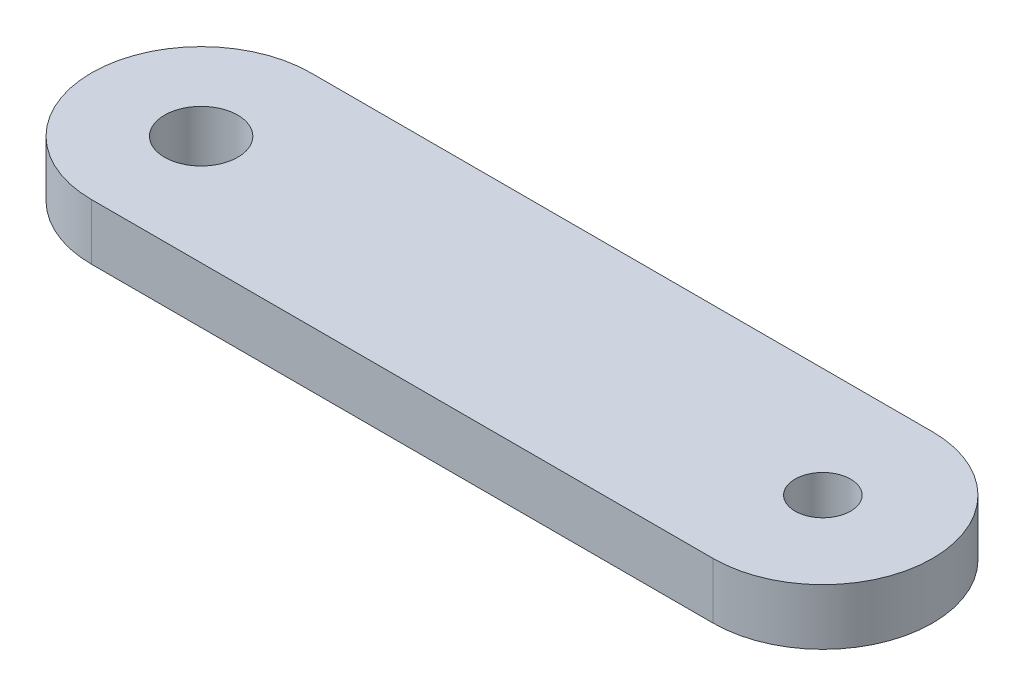
from build123d import *

# Parameters (mm, degrees)
BOSS_EXTRUDE1_DEPTH = 4.8641
SKETCH3_R           = 3.175
SKETCH3_R_2         = 2.413
CUT_EXTRUDE1_DEPTH  = 65.3943716


with BuildPart() as part:
    # Sketch1 → Boss-Extrude1 (new body)
    with BuildSketch(Plane(origin=(0, 0, 0), x_dir=(1, 0, 0), z_dir=(0, 1, 0))):
        with BuildLine():
            Line((-53.975, 9.525), (0, 9.525))
            ThreePointArc((0, 9.525), (9.525, 0), (0, -9.525))
            Line((0, -9.525), (-53.975, -9.525))
            ThreePointArc((-53.975, -9.525), (-63.5, 0), (-53.975, 9.525))
        make_face()
    extrude(amount=BOSS_EXTRUDE1_DEPTH)

    # Sketch3 → Cut-Extrude1 (cut, through all)
    with BuildSketch(Plane(origin=(0, 4.8641, 0), x_dir=(1, 0, 0), z_dir=(0, 1, 0))):
        with Locations(Location((-53.975, 0, 0), (0, 0, 270))):
            Circle(SKETCH3_R)
        with Locations(Location((0, 0, 0), (0, 0, 270))):
            Circle(SKETCH3_R_2)
    extrude(amount=-CUT_EXTRUDE1_DEPTH, mode=Mode.SUBTRACT)


solid = part.part
